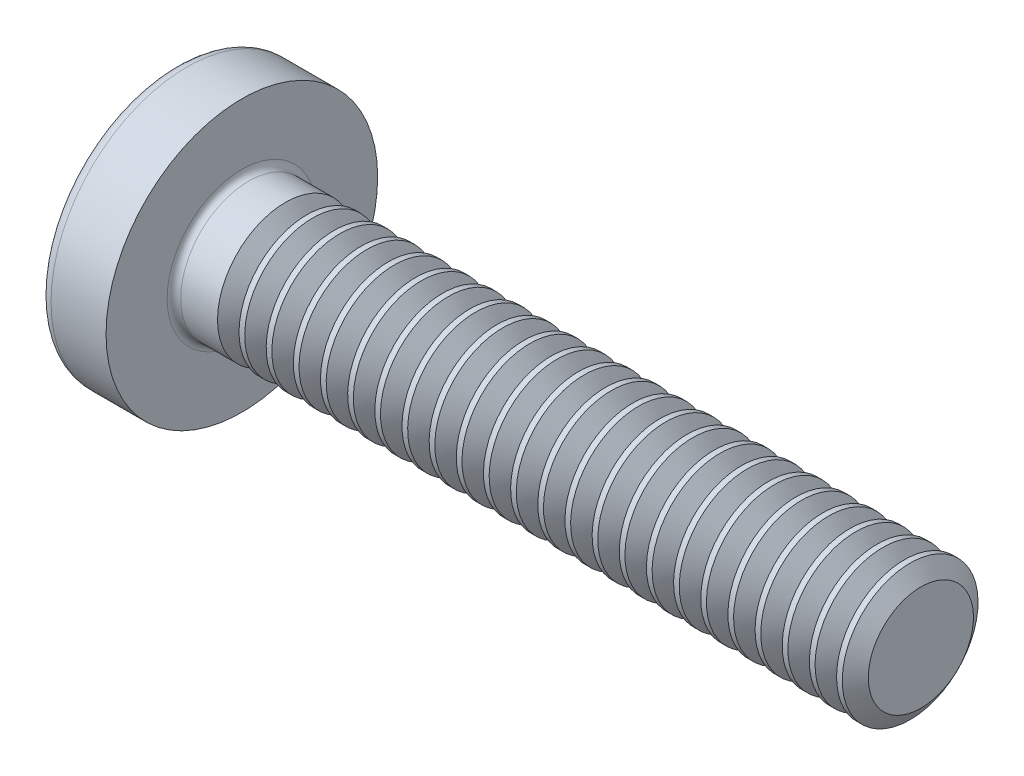
from build123d import *

# Parameters (mm, degrees)
FILLET1_R       = 0.1
RECPAT_COUNT    = 2
RECPAT_ANGLE    = 90
THDSCHPAT_COUNT = 24
THDSCHPAT_PITCH = 0.4


with BuildPart() as part:
    # BodySke → Base-Revolve (revolve)
    with BuildSketch(Plane.XY, mode=Mode.PRIVATE) as base_revolve_sk:
        with BuildLine():
            Line((1.6, 1), (1.6, 2))
            Line((1.6, 2), (0.790020747, 2))
            ThreePointArc((0.790020747, 2), (0.709789294, 1.981130115), (0.646379599, 1.928476821))
            ThreePointArc((0.646379599, 1.928476821), (0.165895084, 1.016959861), (0, 0))
            Line((0, 0), (11.6, 0))
            Line((11.6, 0), (11.6, 1))
            Line((11.6, 1), (1.6, 1))
        make_face()
    revolve(base_revolve_sk.sketch.rotate(Axis((0.790020747, 0, 0), (1, 0, 0)), 90), axis=Axis((0.790020747, 0, 0), (1, 0, 0)))

    # Fillet1
    fillet1_edges = [part.edges().sort_by_distance(p)[0] for p in [
        (1.6, 0, -1),
    ]]
    fillet(fillet1_edges, radius=FILLET1_R)

    # Sketch3 → Recess section 0
    with BuildSketch(Plane(origin=(0, 0, 0), x_dir=(0, 0, -1), z_dir=(1, 0, 0))):
        with BuildLine():
            Line((0.24, -1.05), (-0.24, -1.05))
            Line((-0.24, -1.05), (-0.24, 1.05))
            Line((-0.24, 1.05), (0.24, 1.05))
            Line((0.24, 1.05), (0.24, -1.05))
        make_face()
    # Sketch4 → Recess section 1
    with BuildSketch(Plane(origin=(1.42, 0, 0), x_dir=(0, 0, -1), z_dir=(1, 0, 0))):
        with BuildLine():
            Line((0.24, -0.342014235), (-0.24, -0.342014235))
            Line((-0.24, -0.342014235), (-0.24, 0.342014235))
            Line((-0.24, 0.342014235), (0.24, 0.342014235))
            Line((0.24, 0.342014235), (0.24, -0.342014235))
        make_face()
    recess = loft(mode=Mode.SUBTRACT)

    # RecPat: Recess ×2 about axis
    recpat_axis = Axis((0, 0, 0), (1, 0, 0))
    for i in range(1, RECPAT_COUNT):
        add(recess.rotate(recpat_axis, i * RECPAT_ANGLE / (RECPAT_COUNT - 1)), mode=Mode.SUBTRACT)

    # RecCorSke → RecessCore (revolve, cut)
    with BuildSketch(Plane.XY, mode=Mode.PRIVATE) as recesscore_sk:
        Polygon((0, 0), (0, 0.454796073), (1.42, 0.3555), (1.535508952, 0), align=None)
    revolve(recesscore_sk.sketch.rotate(Axis((-3.175, 0, 0), (1, 0, 0)), 13.894577695), axis=Axis((-3.175, 0, 0), (1, 0, 0)), mode=Mode.SUBTRACT)

    # ThdSchSke → ThreadSchematic (revolve, cut)
    with BuildSketch(Plane.XY, mode=Mode.PRIVATE) as threadschematic_sk:
        Polygon((2.4, -0.774), (2.241753096, -1), (2.241753096, -1.25), (2.558246904, -1.25), (2.558246904, -1), align=None)
    threadschematic = revolve(threadschematic_sk.sketch.rotate(Axis((-3.175, 0, 0), (1, 0, 0)), 270), axis=Axis((-3.175, 0, 0), (1, 0, 0)), mode=Mode.SUBTRACT)

    # ThdSchPat: ThreadSchematic ×24
    with Locations(*[(i * THDSCHPAT_PITCH, 0, 0) for i in range(1, THDSCHPAT_COUNT)]):
        add(threadschematic, mode=Mode.SUBTRACT)


solid = part.part
